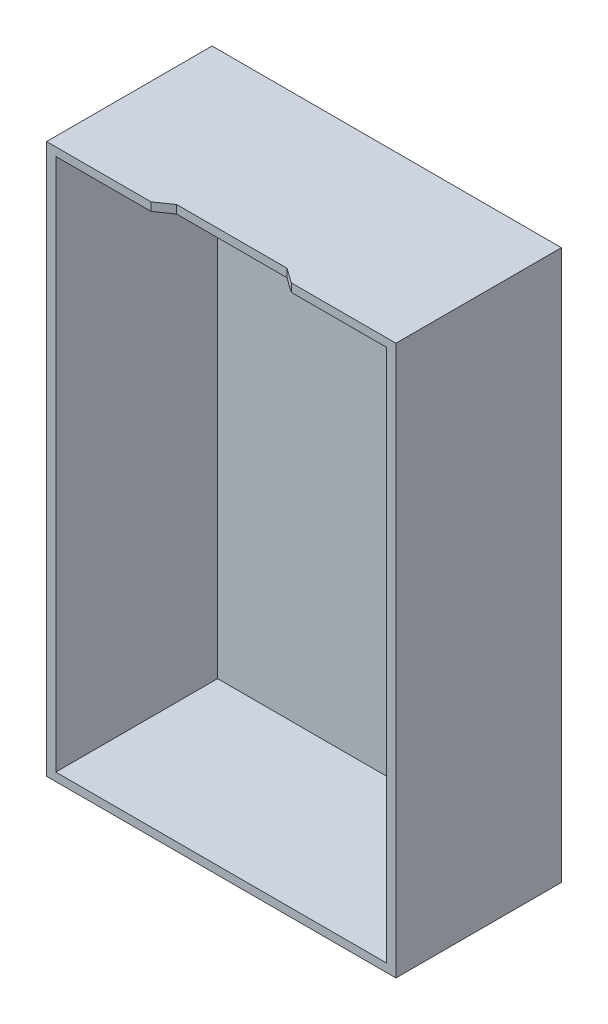
from build123d import *

# Parameters (mm, degrees)
SKETCH1_W           = 241.3
SKETCH1_H           = 114.3
BOSS_EXTRUDE1_DEPTH = 379.73
SKETCH2_W           = 228.6
SKETCH2_H           = 368.3
CUT_EXTRUDE1_DEPTH  = 111.76
CUT_EXTRUDE2_DEPTH  = 111.76


with BuildPart() as part:
    # Sketch1 → Boss-Extrude1 (new body)
    with BuildSketch(Plane(origin=(0, 0, 0), x_dir=(1, 0, 0), z_dir=(0, 1, 0))):
        Rectangle(SKETCH1_W, SKETCH1_H)
    extrude(amount=BOSS_EXTRUDE1_DEPTH)

    # Sketch2 → Cut-Extrude1 (cut)
    with BuildSketch(Plane.XY.offset(57.15)):
        with Locations((0, 189.865)):
            Rectangle(SKETCH2_W, SKETCH2_H)
    extrude(amount=-CUT_EXTRUDE1_DEPTH, mode=Mode.SUBTRACT)

    # Sketch3 → Cut-Extrude2 (cut)
    with BuildSketch(Plane(origin=(0, 379.73, 0), x_dir=(1, 0, 0), z_dir=(0, 1, 0))):
        Polygon((-38.1, -49.883610426), (-48.510901929, -57.15), (48.384797494, -57.15), (38.1, -49.883610426), align=None)
    extrude(amount=-CUT_EXTRUDE2_DEPTH, mode=Mode.SUBTRACT)


solid = part.part
